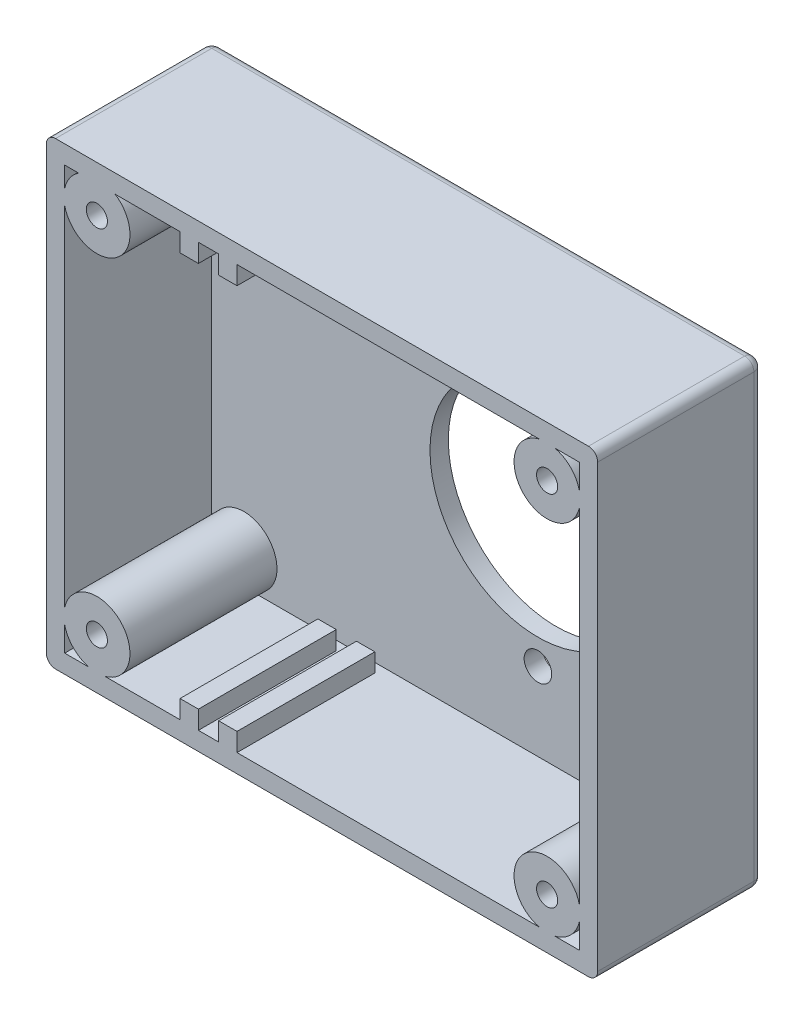
from build123d import *

# Parameters (mm, degrees)
SKETCH2_W            = 60
SKETCH2_H            = 50
BOSS_EXTRUDE1_DEPTH  = 9
SHELL1_T             = -2
SKETCH6_R            = 11.75
SKETCH6_R_2          = 1.5
CUT_EXTRUDE3_DEPTH   = 18
SKETCH8_R            = 3.6
BOSS_EXTRUDE7_DEPTH  = 16
SKETCH10_R           = 3.6
BOSS_EXTRUDE8_DEPTH  = 16
SKETCH11_R           = 1.15
CUT_EXTRUDE4_DEPTH   = 17
SKETCH12_W           = 2
SKETCH12_H           = 2
BOSS_EXTRUDE13_DEPTH = 15
FILLET3_R            = 1


with BuildPart() as part:
    # Sketch2 → Boss-Extrude1 (new, symmetric)
    with BuildSketch(Plane.XY):
        Rectangle(SKETCH2_W, SKETCH2_H)
    extrude(amount=BOSS_EXTRUDE1_DEPTH, both=True)

    # Shell1
    shell1_openings = [part.faces().sort_by_distance(p)[0] for p in [
        (0, 0, 9),
    ]]
    offset(amount=SHELL1_T, openings=shell1_openings, kind=Kind.INTERSECTION)

    # Sketch6 → Cut-Extrude3 (cut)
    with BuildSketch(Plane(origin=(0, 0, -9), x_dir=(-1, 0, 0), z_dir=(0, 0, -1))):
        with Locations((-7.5, 0)):
            Circle(SKETCH6_R)
        with Locations((-7.5, 14.5)):
            Circle(SKETCH6_R_2)
        with Locations((-7.5, -14.5)):
            Circle(SKETCH6_R_2)
    extrude(amount=-CUT_EXTRUDE3_DEPTH, mode=Mode.SUBTRACT)

    # Sketch8 → Boss-Extrude7 (add, through all)
    with BuildSketch(Plane.XY.offset(-7)):
        with Locations((-24.5, 20)):
            Circle(SKETCH8_R)
    extrude(amount=BOSS_EXTRUDE7_DEPTH)

    # Sketch10 → Boss-Extrude8 (add, through all)
    with BuildSketch(Plane.XY.offset(-7)):
        with Locations((24.5, -19.5)):
            Circle(SKETCH10_R)
        with Locations((24.5, 19.5)):
            Circle(SKETCH10_R)
        with Locations((-24.5, -19.5)):
            Circle(SKETCH10_R)
    extrude(amount=BOSS_EXTRUDE8_DEPTH)

    # Sketch11 → Cut-Extrude4 (cut)
    with BuildSketch(Plane.XY.offset(9)):
        with Locations((-24.5, 20)):
            Circle(SKETCH11_R)
        with Locations((24.5, 19.5)):
            Circle(SKETCH11_R)
        with Locations((24.5, -19.5)):
            Circle(SKETCH11_R)
        with Locations((-24.5, -19.5)):
            Circle(SKETCH11_R)
    extrude(amount=-CUT_EXTRUDE4_DEPTH, mode=Mode.SUBTRACT)

    # Sketch12 → Boss-Extrude13 (add)
    with BuildSketch(Plane.XY.offset(9)):
        with Locations((-10.25, -22)):
            Rectangle(SKETCH12_W, SKETCH12_H)
        with Locations((-14.45, -22)):
            Rectangle(SKETCH12_W, SKETCH12_H)
        with Locations((-14.45, 22)):
            Rectangle(SKETCH12_W, SKETCH12_H)
        with Locations((-10.25, 22)):
            Rectangle(SKETCH12_W, SKETCH12_H)
    extrude(amount=-BOSS_EXTRUDE13_DEPTH)

    # Fillet3
    fillet3_edges = [part.edges().sort_by_distance(p)[0] for p in [
        (0, -25, -9),
        (-30, 0, -9),
        (0, 25, -9),
        (30, 0, -9),
        (30, -25, 0),
        (-30, -25, 0),
        (-30, 25, 0),
        (30, 25, 0),
    ]]
    fillet(fillet3_edges, radius=FILLET3_R)


solid = part.part
